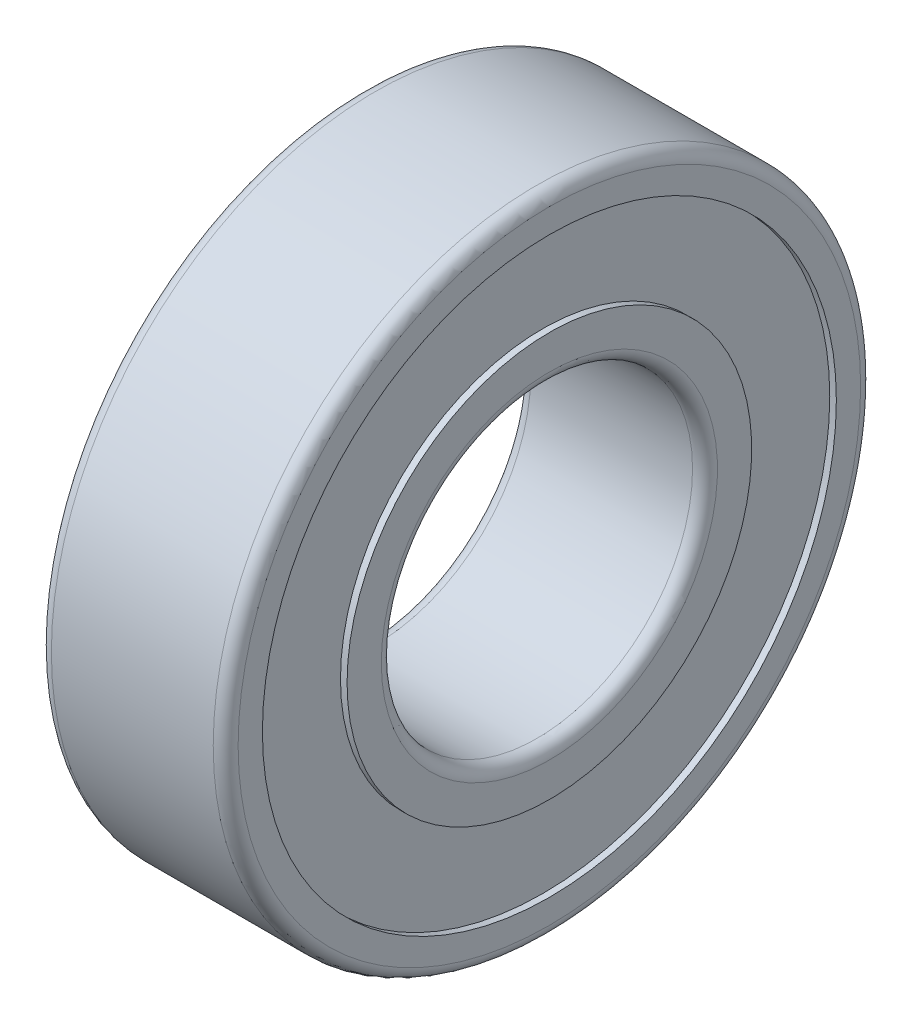
from build123d import *


with BuildPart() as part:
    # Sketch1 → Revolve1 (revolve)
    with BuildSketch(Plane.XY, mode=Mode.PRIVATE) as revolve1_sk:
        with BuildLine():
            Line((0, 25), (0, 23.05))
            Line((0, 23.05), (0.53, 23.05))
            Line((0.53, 23.05), (0.53, 16.25))
            Line((0.53, 16.25), (0, 16.25))
            Line((0, 16.25), (0, 13.5))
            ThreePointArc((0, 13.5), (0.292893219, 12.792893219), (1, 12.5))
            Line((1, 12.5), (14, 12.5))
            ThreePointArc((14, 12.5), (14.707106781, 12.792893219), (15, 13.5))
            Line((15, 13.5), (15, 16.25))
            Line((15, 16.25), (14.47, 16.25))
            Line((14.47, 16.25), (14.47, 23.05))
            Line((14.47, 23.05), (15, 23.05))
            Line((15, 23.05), (15, 25))
            ThreePointArc((15, 25), (14.707106781, 25.707106781), (14, 26))
            Line((14, 26), (1, 26))
            ThreePointArc((1, 26), (0.292893219, 25.707106781), (0, 25))
        make_face()
    revolve(revolve1_sk.sketch.rotate(Axis((15, 0, 0), (-1, 0, 0)), 270), axis=Axis((15, 0, 0), (-1, 0, 0)))


solid = part.part
